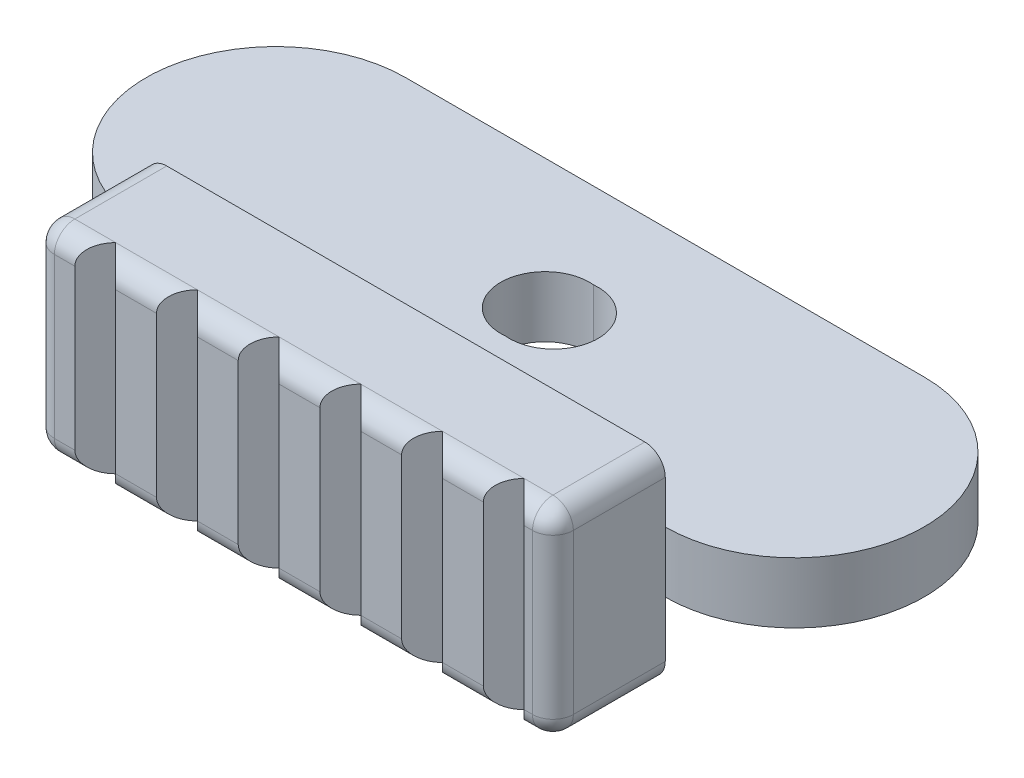
from build123d import *

# Parameters (mm, degrees)
BOSS_EXTRUDE1_DEPTH = 2.975
SKETCH2_W           = 25.407464895
SKETCH2_H           = 9.803414335
BOSS_EXTRUDE2_DEPTH = 5.5
FILLET1_R           = 1
FILLET2_R           = 1
FILLET3_R           = 1
FILLET4_R           = 1
CUT_EXTRUDE3_DEPTH  = 10
SKETCH6_R           = 2.175
CUT_EXTRUDE4_DEPTH  = 10
SKETCH5_R           = 2.175
CUT_EXTRUDE2_DEPTH  = 10


with BuildPart() as part:
    # Sketch1 → Boss-Extrude1 (new body)
    with BuildSketch(Plane(origin=(0, 0, 0), x_dir=(1, 0, 0), z_dir=(0, 1, 0))):
        with BuildLine():
            Line((-23.171929825, 5.625877193), (2.228070175, 5.625877193))
            ThreePointArc((2.228070175, 5.625877193), (8.578070175, -0.724122807), (2.228070175, -7.074122807))
            Line((2.228070175, -7.074122807), (-23.171929825, -7.074122807))
            ThreePointArc((-23.171929825, -7.074122807), (-29.521929825, -0.724122807), (-23.171929825, 5.625877193))
        make_face()
    extrude(amount=BOSS_EXTRUDE1_DEPTH)

    # Sketch2 → Boss-Extrude2 (add)
    with BuildSketch(Plane.XY.offset(7.074122807)):
        with Locations((-10.460194126, 1.178603883)):
            Rectangle(SKETCH2_W, SKETCH2_H)
    extrude(amount=BOSS_EXTRUDE2_DEPTH)

    # Fillet1
    fillet1_edges = [part.edges().sort_by_distance(p)[0] for p in [
        (-23.163926573, 1.178603883, 12.574122807),
    ]]
    fillet(fillet1_edges, radius=FILLET1_R)

    # Fillet2
    fillet2_edges = [part.edges().sort_by_distance(p)[0] for p in [
        (2.243538322, 1.178603883, 12.574122807),
    ]]
    fillet(fillet2_edges, radius=FILLET2_R)

    # Fillet3
    fillet3_edges = [part.edges().sort_by_distance(p)[0] for p in [
        (-10.460194125, -3.723103285, 12.574122807),
        (-23.163926573, -3.723103285, 9.324122807),
        (-22.871033354, -3.723103285, 12.281229588),
        (2.243538322, -3.723103285, 9.324122807),
        (1.950645103, -3.723103285, 12.281229588),
    ]]
    fillet(fillet3_edges, radius=FILLET3_R)

    # Fillet4
    fillet4_edges = [part.edges().sort_by_distance(p)[0] for p in [
        (-23.163926573, 6.08031105, 9.324122807),
        (-22.871033354, 6.08031105, 12.281229588),
        (-10.460194125, 6.08031105, 12.574122807),
        (2.243538322, 6.08031105, 9.324122807),
        (1.950645103, 6.08031105, 12.281229588),
    ]]
    fillet(fillet4_edges, radius=FILLET4_R)

    # Sketch4 → Cut-Extrude3 (cut)
    with BuildSketch(Plane.XZ.offset(3.723103285)):
        Polygon((-15.163926573, 12.574122807), (-17.163926573, 12.574122807), (-16.163926519, 11.574122807), align=None)
        Polygon((-11.163926573, 12.574122807), (-13.163926573, 12.574122807), (-12.163926519, 11.574122807), align=None)
        Polygon((-7.163926573, 12.574122807), (-9.163926573, 12.574122807), (-8.163926519, 11.574122807), align=None)
        Polygon((-3.163926573, 12.574122807), (-5.163926573, 12.574122807), (-4.163926519, 11.574122807), align=None)
        Polygon((0.836073427, 12.574122807), (-1.163926573, 12.574122807), (-0.163926519, 11.574122807), align=None)
        Polygon((-21.163926573, 12.574122807), (-19.163926573, 12.574122807), (-20.163926519, 11.574122807), align=None)
    extrude(amount=-CUT_EXTRUDE3_DEPTH, mode=Mode.SUBTRACT)

    # Sketch6 → Cut-Extrude4 (cut)
    with BuildSketch(Plane(origin=(0, 2.975, 0), x_dir=(1, 0, 0), z_dir=(0, 1, 0))):
        with Locations(Location((-9.568561245, -0.724122807, 0), (0, 0, 270))):
            Circle(SKETCH6_R)
    extrude(amount=-CUT_EXTRUDE4_DEPTH, mode=Mode.SUBTRACT)

    # Sketch5 → Cut-Extrude2 (cut)
    with BuildSketch(Plane.XZ):
        with Locations((-9.989014044, 0.724122807)):
            Circle(SKETCH5_R)
    extrude(amount=-CUT_EXTRUDE2_DEPTH, mode=Mode.SUBTRACT)


solid = part.part
